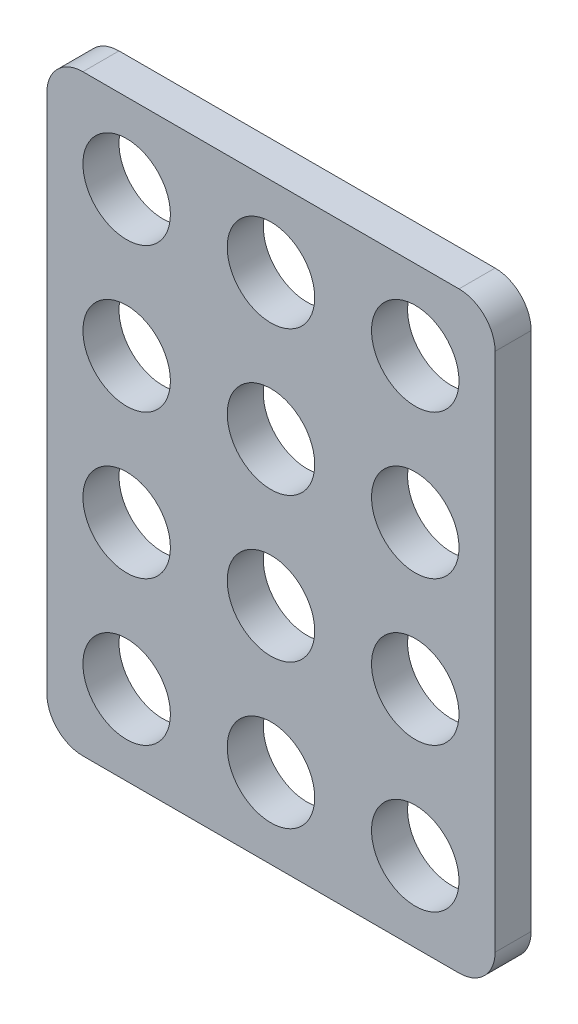
from build123d import *

# Parameters (mm, degrees)
BOSS_EXTRUDE2_DEPTH = 2
SKETCH2_R           = 2.425
CUT_EXTRUDE1_DEPTH  = 2


with BuildPart() as part:
    # Sketch1 → Boss-Extrude2 (new body)
    with BuildSketch(Plane.XY):
        with BuildLine():
            Line((2, 0), (22.85, 0))
            ThreePointArc((22.85, 0), (24.264213562, 0.585786438), (24.85, 2))
            Line((24.85, 2), (24.85, 30.85))
            ThreePointArc((24.85, 30.85), (24.264213562, 32.264213562), (22.85, 32.85))
            Line((22.85, 32.85), (2, 32.85))
            ThreePointArc((2, 32.85), (0.585786438, 32.264213562), (0, 30.85))
            Line((0, 30.85), (0, 2))
            ThreePointArc((0, 2), (0.585786438, 0.585786438), (2, 0))
        make_face()
    extrude(amount=BOSS_EXTRUDE2_DEPTH)

    # Sketch2 → Cut-Extrude1 (cut)
    with BuildSketch(Plane.XY.offset(2)):
        with Locations((4.425, 4.425)):
            Circle(SKETCH2_R)
        with Locations((12.425, 4.425)):
            Circle(SKETCH2_R)
        with Locations((20.425, 4.425)):
            Circle(SKETCH2_R)
        with Locations((4.425, 12.425)):
            Circle(SKETCH2_R)
        with Locations((12.425, 12.425)):
            Circle(SKETCH2_R)
        with Locations((20.425, 12.425)):
            Circle(SKETCH2_R)
        with Locations((4.425, 20.425)):
            Circle(SKETCH2_R)
        with Locations((12.425, 20.425)):
            Circle(SKETCH2_R)
        with Locations((20.425, 20.425)):
            Circle(SKETCH2_R)
        with Locations((4.425, 28.425)):
            Circle(SKETCH2_R)
        with Locations((12.425, 28.425)):
            Circle(SKETCH2_R)
        with Locations((20.425, 28.425)):
            Circle(SKETCH2_R)
    extrude(amount=-CUT_EXTRUDE1_DEPTH, mode=Mode.SUBTRACT)


solid = part.part
